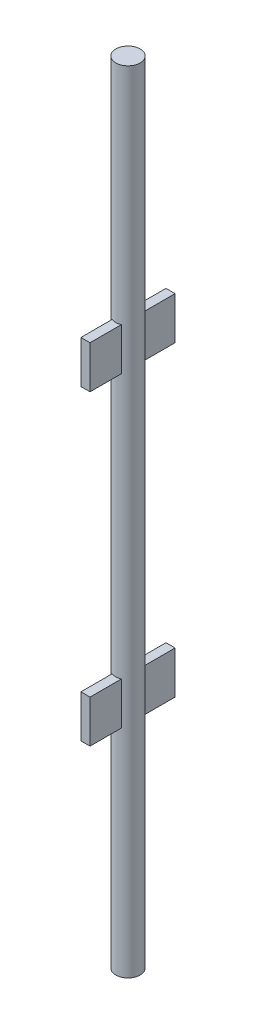
from build123d import *

# Parameters (mm, degrees)
ESQUISSE1_R        = 20
BOSS_EXTRU_1_DEPTH = 1300
ESQUISSE2_W        = 15
ESQUISSE2_H        = 70
BOSS_EXTRU_2_DEPTH = 70
ESQUISSE4_W        = 15
ESQUISSE4_H        = 70
BOSS_EXTRU_3_DEPTH = 70


with BuildPart() as part:
    # Esquisse1 → Boss.-Extru.1 (new body)
    with BuildSketch(Plane(origin=(0, 0, 0), x_dir=(1, 0, 0), z_dir=(0, 1, 0))):
        with Locations(Location((0, 0, 0), (0, 0, 270))):
            Circle(ESQUISSE1_R)
    extrude(amount=BOSS_EXTRU_1_DEPTH)

    # Esquisse2 → Boss.-Extru.2 (add, symmetric)
    with BuildSketch(Plane.XY):
        with Locations((0, 390)):
            Rectangle(ESQUISSE2_W, ESQUISSE2_H)
    extrude(amount=BOSS_EXTRU_2_DEPTH, both=True)

    # Esquisse4 → Boss.-Extru.3 (add, symmetric)
    with BuildSketch(Plane.XY):
        with Locations((0, 895)):
            Rectangle(ESQUISSE4_W, ESQUISSE4_H)
    extrude(amount=BOSS_EXTRU_3_DEPTH, both=True)


solid = part.part
